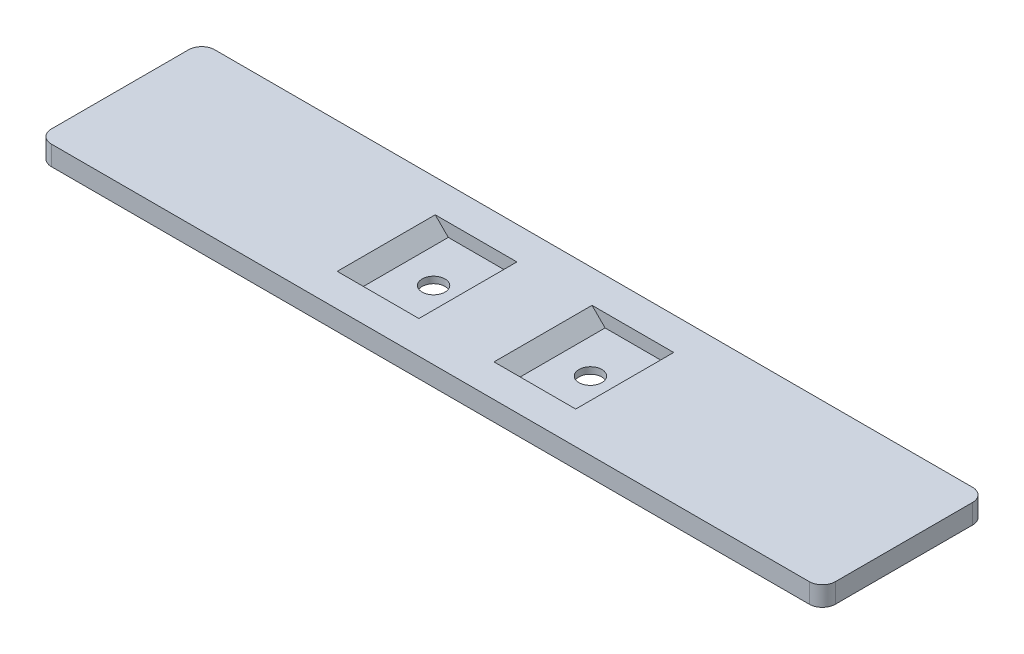
from build123d import *

# Parameters (mm, degrees)
TOP_COVER_W             = 120
TOP_COVER_H             = 25
BOSS_EXTRUDE1_DEPTH     = 3
ATTACHMENT_POINT_W      = 10.5
ATTACHMENT_POINT_H      = 15
CUT_EXTRUDE1_DEPTH      = 2
SKETCH4_R               = 1.75
M3_SCREW_CUT_DEPTH      = 62.361632964
FILLET1_R               = 2
FILLET2_R               = 2
FILLET3_R               = 2
FILLET4_R               = 2
SKETCH5_W               = 3
SKETCH5_H               = 15
CUT_EXTRUDE3_DEPTH      = 2
CONNETOR_1_ANGLE_DEPTH  = 15
CONNECTOR_2_ANGLE_DEPTH = 15


with BuildPart() as part:
    # Top Cover → Boss-Extrude1 (new body)
    with BuildSketch(Plane(origin=(0, 0, 0), x_dir=(1, 0, 0), z_dir=(0, 1, 0))):
        Rectangle(TOP_COVER_W, TOP_COVER_H)
    extrude(amount=BOSS_EXTRUDE1_DEPTH)

    # Attachment Point → Cut-Extrude1 (cut)
    with BuildSketch(Plane(origin=(0, 3, 0), x_dir=(1, 0, 0), z_dir=(0, 1, 0))):
        with Locations((-12, 0)):
            Rectangle(ATTACHMENT_POINT_W, ATTACHMENT_POINT_H)
        with Locations((12, 0)):
            Rectangle(ATTACHMENT_POINT_W, ATTACHMENT_POINT_H)
    extrude(amount=-CUT_EXTRUDE1_DEPTH, mode=Mode.SUBTRACT)

    # Sketch4 → M3 Screw CUT (cut, through all)
    with BuildSketch(Plane(origin=(0, 3, 0), x_dir=(1, 0, 0), z_dir=(0, 1, 0))):
        with Locations(Location((-12, 0, 0), (0, 0, 270))):
            Circle(SKETCH4_R)
        with Locations(Location((12, 0, 0), (0, 0, 90))):
            Circle(SKETCH4_R)
    extrude(amount=-M3_SCREW_CUT_DEPTH, mode=Mode.SUBTRACT)

    # Fillet1
    fillet1_edges = [part.edges().sort_by_distance(p)[0] for p in [
        (-60, 1.5, 12.5),
    ]]
    fillet(fillet1_edges, radius=FILLET1_R)

    # Fillet2
    fillet2_edges = [part.edges().sort_by_distance(p)[0] for p in [
        (60, 1.5, 12.5),
    ]]
    fillet(fillet2_edges, radius=FILLET2_R)

    # Fillet3
    fillet3_edges = [part.edges().sort_by_distance(p)[0] for p in [
        (60, 1.5, -12.5),
    ]]
    fillet(fillet3_edges, radius=FILLET3_R)

    # Fillet4
    fillet4_edges = [part.edges().sort_by_distance(p)[0] for p in [
        (-60, 1.5, -12.5),
    ]]
    fillet(fillet4_edges, radius=FILLET4_R)

    # Sketch5 → Cut-Extrude3 (cut)
    with BuildSketch(Plane(origin=(0, 3, 0), x_dir=(1, 0, 0), z_dir=(0, 1, 0))):
        with Locations((5.25, 0)):
            Rectangle(SKETCH5_W, SKETCH5_H)
        with Locations((-18.75, 0)):
            Rectangle(SKETCH5_W, SKETCH5_H)
    extrude(amount=-CUT_EXTRUDE3_DEPTH, mode=Mode.SUBTRACT)

    # Sketch6 → Connetor 1 Angle (add)
    with BuildSketch(Plane(origin=(0, 0, 7.5), x_dir=(-1, 0, 0), z_dir=(0, 0, -1))):
        Polygon((-4.75, 3), (-6.75, 1), (-3.75, 1), (-3.75, 3), align=None)
    extrude(amount=CONNETOR_1_ANGLE_DEPTH)

    # Sketch7 → Connector 2 Angle (add)
    with BuildSketch(Plane(origin=(0, 0, 7.5), x_dir=(-1, 0, 0), z_dir=(0, 0, -1))):
        Polygon((19.25, 3), (17.25, 1), (20.25, 1), (20.25, 3), align=None)
    extrude(amount=CONNECTOR_2_ANGLE_DEPTH)


solid = part.part
